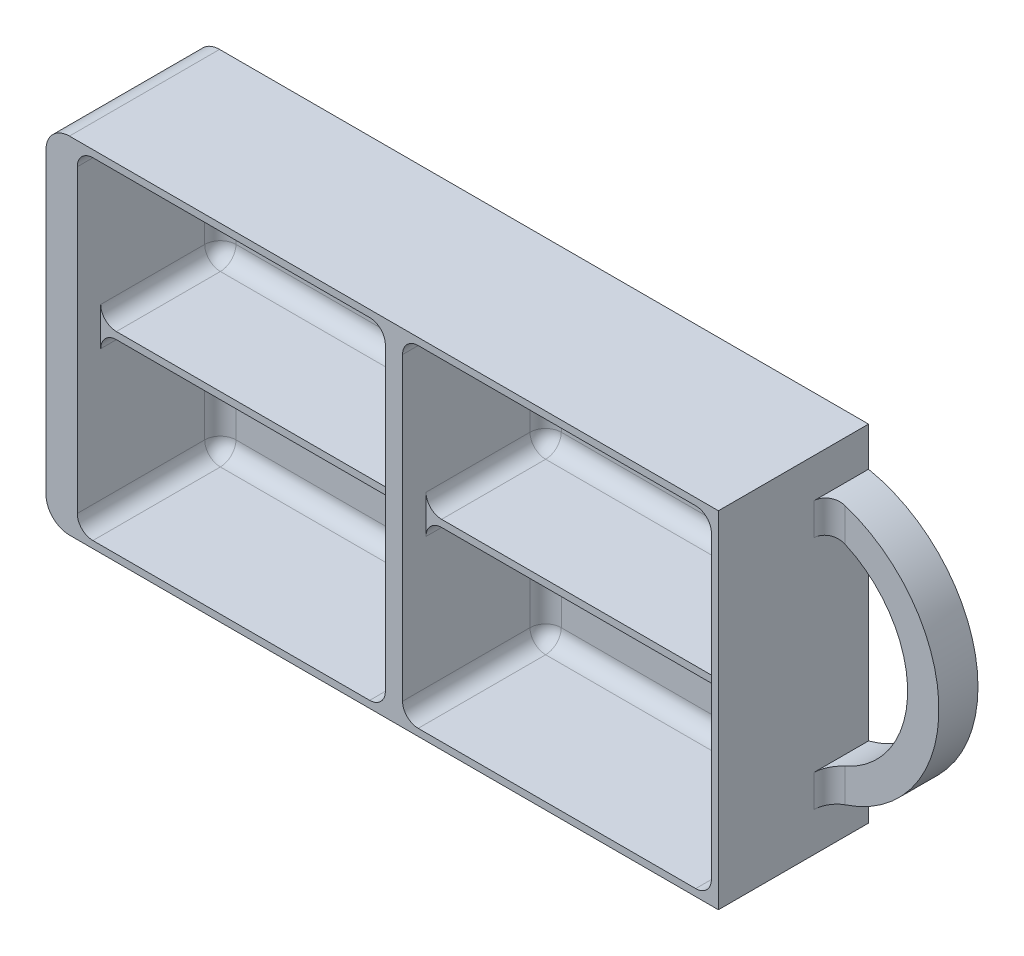
from build123d import *

# Parameters (mm, degrees)
SKETCH_1_W                  = 86
SKETCH_1_H                  = 44.2
EXTRUDE_1_DEPTH             = 14.2
EXTRUDE_2_DEPTH             = 5
SKETCH_3_W                  = 81.1
SKETCH_3_H                  = 42.4
CUT_EXTRUDE_1_DEPTH         = 18.3
HOLE_WIZARD_8_3_8_3_1_D     = 8.3
HOLE_WIZARD_8_3_8_3_1_DEPTH = 3.2
RIB_1_REACH                 = 108.755
SKETCH_6_WALL_W             = 296.60943773
SKETCH_6_WALL_H             = 0.9
FILLET_1_R                  = 3
EXTRUDE_START               = -3.5
SKETCH_7_R                  = 4.15
EXTRUDE_3_DEPTH             = 3.5
FILLET_2_R                  = 2
SKETCH_9_W                  = 2.2
SKETCH_9_H                  = 19.2
EXTRUDE_4_DEPTH             = 44
FILLET_3_R                  = 2


with BuildPart() as part:
    # Эскиз1 → Бобышка-Вытянуть1 (new body)
    with BuildSketch(Plane.XY.offset(9.6)):
        with Locations((47, 0)):
            Rectangle(SKETCH_1_W, SKETCH_1_H)
    extrude(amount=-EXTRUDE_1_DEPTH)

    # Эскиз2 → Бобышка-Вытянуть2 (add)
    with BuildSketch(Plane(origin=(0, 0, -4.6), x_dir=(-1, 0, 0), z_dir=(0, 0, -1))):
        with BuildLine():
            Line((-90, -22.1), (-90, -17.1))
            ThreePointArc((-90, -17.1), (-104, 0), (-90, 17.1))
            Line((-90, 17.1), (-90, 22.1))
            Line((-90, 22.1), (-4, 22.1))
            Line((-4, 22.1), (-4, -22.1))
            Line((-4, -22.1), (-90, -22.1))
        make_face()
        with BuildLine():
            Line((-90, -12.994779171), (-90, 12.994779171))
            ThreePointArc((-90, 12.994779171), (-100, 0), (-90, -12.994779171))
        make_face(mode=Mode.SUBTRACT)
    extrude(amount=EXTRUDE_2_DEPTH)

    # Эскиз3 → Вырез-Вытянуть1 (cut)
    with BuildSketch(Plane.XY.offset(9.6)):
        with Locations((48.55, 0)):
            Rectangle(SKETCH_3_W, SKETCH_3_H)
    extrude(amount=-CUT_EXTRUDE_1_DEPTH, mode=Mode.SUBTRACT)

    # Диаметр отверстия Ø8.3 (8.3)1
    with Locations(Plane.ZY.offset(-4)):
        with Locations((0, 0)):
            Hole(HOLE_WIZARD_8_3_8_3_1_D / 2, depth=HOLE_WIZARD_8_3_8_3_1_DEPTH)

    # Эскиз6 wall → Ребро1 (add, up to next)
    with BuildSketch(Plane(origin=(48.55, 0, 6.6), x_dir=(1, 0, 0), z_dir=(0, 0, -1)), mode=Mode.PRIVATE) as rib_1_sk1:
        Rectangle(SKETCH_6_WALL_W, SKETCH_6_WALL_H)
    rib_1_tool1 = extrude(rib_1_sk1.sketch, amount=RIB_1_REACH, mode=Mode.PRIVATE) - part.part
    add(rib_1_tool1.solids().sort_by_distance((48.55, 0, 6.6))[0])

    # Скругление1
    fillet_1_edges = [part.edges().sort_by_distance(p)[0] for p in [
        (4, -22.1, 0),
        (4, 22.1, 0),
    ]]
    fillet(fillet_1_edges, radius=FILLET_1_R)

    # Эскиз7 → Бобышка-Вытянуть3 (add)
    with BuildSketch(Plane.ZY.offset(-4).offset(EXTRUDE_START)):
        Circle(SKETCH_7_R)
    extrude(amount=EXTRUDE_3_DEPTH)

    # Скругление2
    fillet_2_edges = [part.edges().sort_by_distance(p)[0] for p in [
        (90, -15.047389586, -4.6),
        (90, 15.047389586, -4.6),
        (8, 10.825, -8.7),
        (8, -21.2, 0.45),
        (48.55, 21.2, -8.7),
        (8, 21.2, 0.45),
        (89.1, -10.825, -8.7),
        (89.1, 21.2, 0.45),
        (48.55, -21.2, -8.7),
        (89.1, -21.2, 0.45),
        (8, -10.825, -8.7),
        (89.1, 10.825, -8.7),
        (48.55, 0.45, -8.7),
        (8, 0.45, -1.05),
        (89.1, 0.45, -1.05),
        (8, -0.45, -1.05),
        (89.1, -0.45, -1.05),
        (48.55, -0.45, -8.7),
    ]]
    fillet(fillet_2_edges, radius=FILLET_2_R)

    # Эскиз9 → Бобышка-Вытянуть4 (add)
    with BuildSketch(Plane(origin=(0, 22.1, 0), x_dir=(1, 0, 0), z_dir=(0, 1, 0))):
        with Locations((48.5, 0)):
            Rectangle(SKETCH_9_W, SKETCH_9_H)
    extrude(amount=-EXTRUDE_4_DEPTH)

    # Скругление3
    fillet_3_edges = [part.edges().sort_by_distance(p)[0] for p in [
        (47.4, 1.035786438, -8.114213562),
        (49.6, 1.035786438, -8.114213562),
        (49.6, -10.825, -8.7),
        (49.6, 0.45, -0.05),
        (49.6, 10.825, -8.7),
        (47.4, 10.825, -8.7),
        (47.4, 0.45, -0.05),
        (47.4, -10.825, -8.7),
        (49.6, -20.614213562, -8.114213562),
        (49.6, -21.2, 1.45),
        (49.6, 21.2, 1.45),
        (49.6, 20.614213562, -8.114213562),
        (49.6, -0.45, -0.05),
        (49.6, -1.035786438, -8.114213562),
        (47.4, -21.2, 1.45),
        (47.4, -20.614213562, -8.114213562),
        (47.4, -1.035786438, -8.114213562),
        (47.4, -0.45, -0.05),
        (47.4, 20.614213562, -8.114213562),
        (47.4, 21.2, 1.45),
    ]]
    fillet(fillet_3_edges, radius=FILLET_3_R)


solid = part.part
